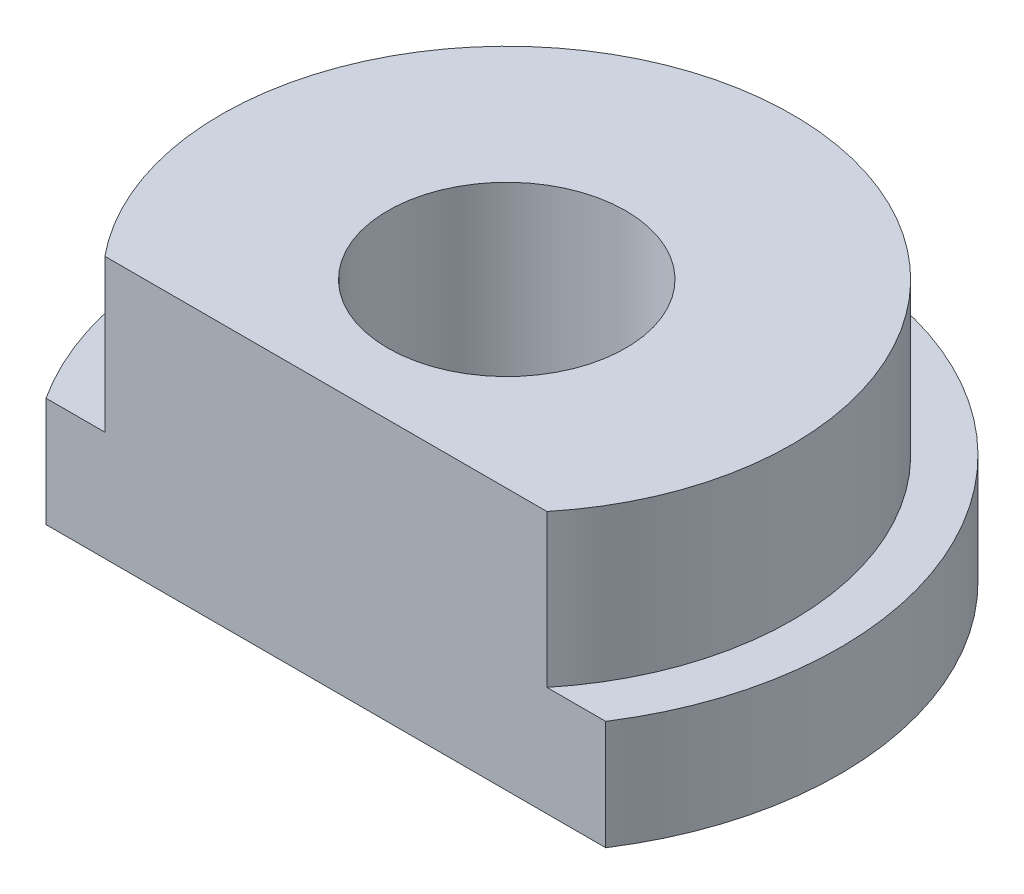
from build123d import *

# Parameters (mm, degrees)
CUT_EXTRUDE_1_DEPTH = 6.662375826


with BuildPart() as part:
    # ｽｹｯﾁ1 → 回転1 (revolve)
    with BuildSketch(Plane.XY, mode=Mode.PRIVATE) as revolve_1_sk:
        Polygon((1.25, 0), (1.25, 2.75), (3, 2.75), (3, 1.15), (3.5, 1.15), (3.5, 0), align=None)
    revolve(revolve_1_sk.sketch.rotate(Axis((0, 0, 0), (0, 1, 0)), 90), axis=Axis((0, 0, 0), (0, 1, 0)))

    # ｽｹｯﾁ2 → ｶｯﾄ - 押し出し1 (cut, through all)
    with BuildSketch(Plane(origin=(0, 2.75, 0), x_dir=(1, 0, 0), z_dir=(0, 1, 0))):
        with BuildLine():
            Line((-2.939387691, -1.9), (2.939387691, -1.9))
            ThreePointArc((2.939387691, -1.9), (0, -3.5), (-2.939387691, -1.9))
        make_face()
    extrude(amount=-CUT_EXTRUDE_1_DEPTH, mode=Mode.SUBTRACT)


solid = part.part
